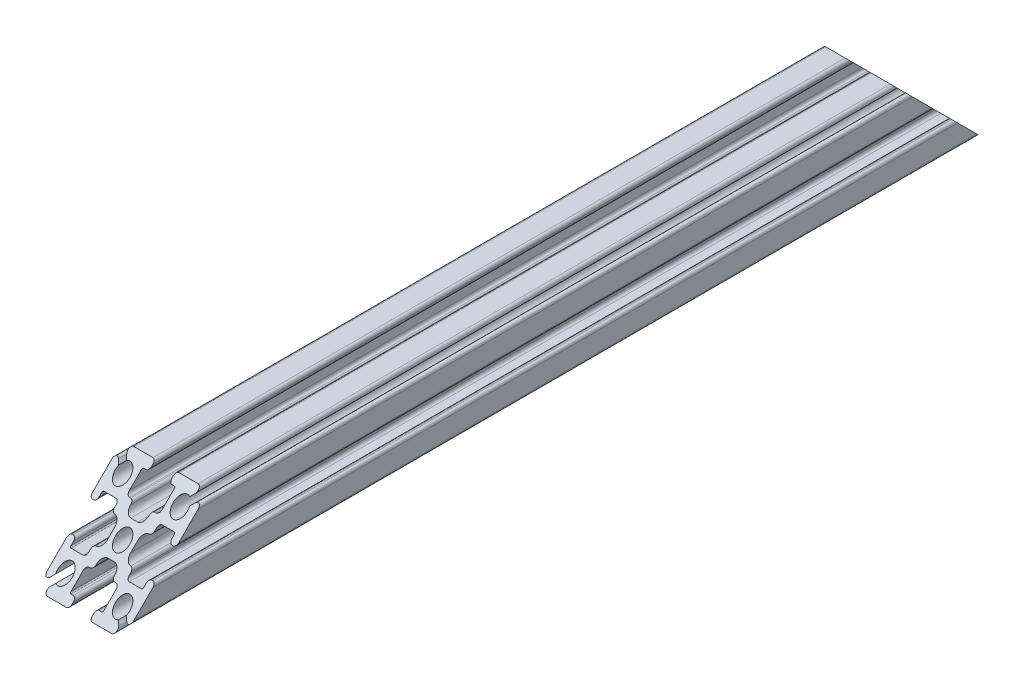
from build123d import *

# Parameters (mm, degrees)
SKETCH1_R           = 1.25
BOSS_EXTRUDE1_DEPTH = 150
CUT_EXTRUDE1_DEPTH  = 8
CUT_EXTRUDE2_DEPTH  = 8


with BuildPart() as part:
    # Sketch1 → Boss-Extrude1 (new body)
    with BuildSketch(Plane(origin=(0, 0, 0), x_dir=(-1, 0, 0), z_dir=(0, 0, -1))):
        with BuildLine():
            Line((6.646446609, 5.939339828), (6.163645978, 5.456539197))
            ThreePointArc((6.163645978, 5.456539197), (4.116116524, 4.116116524), (5.456539197, 6.163645978))
            Line((5.456539197, 6.163645978), (5.939339828, 6.646446609))
            ThreePointArc((5.939339828, 6.646446609), (6.047726204, 7.191341716), (5.585786438, 7.5))
            Line((5.585786438, 7.5), (2.25, 7.5))
            ThreePointArc((2.25, 7.5), (1.896446609, 7.353553391), (1.75, 7))
            Line((1.75, 7), (1.75, 6.8))
            ThreePointArc((1.75, 6.8), (1.896446609, 6.446446609), (2.25, 6.3))
            Line((2.25, 6.3), (2.65, 6.3))
            ThreePointArc((2.65, 6.3), (2.791421356, 6.241421356), (2.85, 6.1))
            Line((2.85, 6.1), (2.85, 4))
            ThreePointArc((2.85, 4), (2.703553391, 3.646446609), (2.35, 3.5))
            Line((2.35, 3.5), (2.1, 3.5))
            ThreePointArc((2.1, 3.5), (1.746446609, 3.353553391), (1.6, 3))
            ThreePointArc((1.6, 3), (1.307106781, 2.292893219), (0.6, 2))
            Line((0.6, 2), (-0.6, 2))
            ThreePointArc((-0.6, 2), (-1.307106781, 2.292893219), (-1.6, 3))
            ThreePointArc((-1.6, 3), (-1.746446609, 3.353553391), (-2.1, 3.5))
            Line((-2.1, 3.5), (-2.35, 3.5))
            ThreePointArc((-2.35, 3.5), (-2.703553391, 3.646446609), (-2.85, 4))
            Line((-2.85, 4), (-2.85, 6.1))
            ThreePointArc((-2.85, 6.1), (-2.791421356, 6.241421356), (-2.65, 6.3))
            Line((-2.65, 6.3), (-2.25, 6.3))
            ThreePointArc((-2.25, 6.3), (-1.896446609, 6.446446609), (-1.75, 6.8))
            Line((-1.75, 6.8), (-1.75, 7))
            ThreePointArc((-1.75, 7), (-1.896446609, 7.353553391), (-2.25, 7.5))
            Line((-2.25, 7.5), (-5.585786438, 7.5))
            ThreePointArc((-5.585786438, 7.5), (-6.047726204, 7.191341716), (-5.939339828, 6.646446609))
            Line((-5.939339828, 6.646446609), (-5.456539197, 6.163645978))
            ThreePointArc((-5.456539197, 6.163645978), (-4.116116524, 4.116116524), (-6.163645978, 5.456539197))
            Line((-6.163645978, 5.456539197), (-6.646446609, 5.939339828))
            ThreePointArc((-6.646446609, 5.939339828), (-7.191341716, 6.047726204), (-7.5, 5.585786438))
            Line((-7.5, 5.585786438), (-7.5, 2.25))
            ThreePointArc((-7.5, 2.25), (-7.353553391, 1.896446609), (-7, 1.75))
            Line((-7, 1.75), (-6.8, 1.75))
            ThreePointArc((-6.8, 1.75), (-6.446446609, 1.896446609), (-6.3, 2.25))
            Line((-6.3, 2.25), (-6.3, 2.65))
            ThreePointArc((-6.3, 2.65), (-6.241421356, 2.791421356), (-6.1, 2.85))
            Line((-6.1, 2.85), (-4, 2.85))
            ThreePointArc((-4, 2.85), (-3.646446609, 2.703553391), (-3.5, 2.35))
            Line((-3.5, 2.35), (-3.5, 2.1))
            ThreePointArc((-3.5, 2.1), (-3.353553391, 1.746446609), (-3, 1.6))
            ThreePointArc((-3, 1.6), (-2.292893219, 1.307106781), (-2, 0.6))
            Line((-2, 0.6), (-2, -0.6))
            ThreePointArc((-2, -0.6), (-2.292893219, -1.307106781), (-3, -1.6))
            ThreePointArc((-3, -1.6), (-3.353553391, -1.746446609), (-3.5, -2.1))
            Line((-3.5, -2.1), (-3.5, -2.35))
            ThreePointArc((-3.5, -2.35), (-3.646446609, -2.703553391), (-4, -2.85))
            Line((-4, -2.85), (-6.1, -2.85))
            ThreePointArc((-6.1, -2.85), (-6.241421356, -2.791421356), (-6.3, -2.65))
            Line((-6.3, -2.65), (-6.3, -2.25))
            ThreePointArc((-6.3, -2.25), (-6.446446609, -1.896446609), (-6.8, -1.75))
            Line((-6.8, -1.75), (-7, -1.75))
            ThreePointArc((-7, -1.75), (-7.353553391, -1.896446609), (-7.5, -2.25))
            Line((-7.5, -2.25), (-7.5, -5.585786438))
            ThreePointArc((-7.5, -5.585786438), (-7.191341716, -6.047726204), (-6.646446609, -5.939339828))
            Line((-6.646446609, -5.939339828), (-6.163645978, -5.456539197))
            ThreePointArc((-6.163645978, -5.456539197), (-4.116116524, -4.116116524), (-5.456539197, -6.163645978))
            Line((-5.456539197, -6.163645978), (-5.939339828, -6.646446609))
            ThreePointArc((-5.939339828, -6.646446609), (-6.047726204, -7.191341716), (-5.585786438, -7.5))
            Line((-5.585786438, -7.5), (-2.25, -7.5))
            ThreePointArc((-2.25, -7.5), (-1.896446609, -7.353553391), (-1.75, -7))
            Line((-1.75, -7), (-1.75, -6.8))
            ThreePointArc((-1.75, -6.8), (-1.896446609, -6.446446609), (-2.25, -6.3))
            Line((-2.25, -6.3), (-2.65, -6.3))
            ThreePointArc((-2.65, -6.3), (-2.791421356, -6.241421356), (-2.85, -6.1))
            Line((-2.85, -6.1), (-2.85, -4))
            ThreePointArc((-2.85, -4), (-2.703553391, -3.646446609), (-2.35, -3.5))
            Line((-2.35, -3.5), (-2.1, -3.5))
            ThreePointArc((-2.1, -3.5), (-1.746446609, -3.353553391), (-1.6, -3))
            ThreePointArc((-1.6, -3), (-1.307106781, -2.292893219), (-0.6, -2))
            Line((-0.6, -2), (0.6, -2))
            ThreePointArc((0.6, -2), (1.307106781, -2.292893219), (1.6, -3))
            ThreePointArc((1.6, -3), (1.746446609, -3.353553391), (2.1, -3.5))
            Line((2.1, -3.5), (2.35, -3.5))
            ThreePointArc((2.35, -3.5), (2.703553391, -3.646446609), (2.85, -4))
            Line((2.85, -4), (2.85, -6.1))
            ThreePointArc((2.85, -6.1), (2.791421356, -6.241421356), (2.65, -6.3))
            Line((2.65, -6.3), (2.25, -6.3))
            ThreePointArc((2.25, -6.3), (1.896446609, -6.446446609), (1.75, -6.8))
            Line((1.75, -6.8), (1.75, -7))
            ThreePointArc((1.75, -7), (1.896446609, -7.353553391), (2.25, -7.5))
            Line((2.25, -7.5), (5.585786438, -7.5))
            ThreePointArc((5.585786438, -7.5), (6.047726204, -7.191341716), (5.939339828, -6.646446609))
            Line((5.939339828, -6.646446609), (5.456539197, -6.163645978))
            ThreePointArc((5.456539197, -6.163645978), (4.116116524, -4.116116524), (6.163645978, -5.456539197))
            Line((6.163645978, -5.456539197), (6.646446609, -5.939339828))
            ThreePointArc((6.646446609, -5.939339828), (7.191341716, -6.047726204), (7.5, -5.585786438))
            Line((7.5, -5.585786438), (7.5, -2.25))
            ThreePointArc((7.5, -2.25), (7.353553391, -1.896446609), (7, -1.75))
            Line((7, -1.75), (6.8, -1.75))
            ThreePointArc((6.8, -1.75), (6.446446609, -1.896446609), (6.3, -2.25))
            Line((6.3, -2.25), (6.3, -2.65))
            ThreePointArc((6.3, -2.65), (6.241421356, -2.791421356), (6.1, -2.85))
            Line((6.1, -2.85), (4, -2.85))
            ThreePointArc((4, -2.85), (3.646446609, -2.703553391), (3.5, -2.35))
            Line((3.5, -2.35), (3.5, -2.1))
            ThreePointArc((3.5, -2.1), (3.353553391, -1.746446609), (3, -1.6))
            ThreePointArc((3, -1.6), (2.292893219, -1.307106781), (2, -0.6))
            Line((2, -0.6), (2, 0.6))
            ThreePointArc((2, 0.6), (2.292893219, 1.307106781), (3, 1.6))
            ThreePointArc((3, 1.6), (3.353553391, 1.746446609), (3.5, 2.1))
            Line((3.5, 2.1), (3.5, 2.35))
            ThreePointArc((3.5, 2.35), (3.646446609, 2.703553391), (4, 2.85))
            Line((4, 2.85), (6.1, 2.85))
            ThreePointArc((6.1, 2.85), (6.241421356, 2.791421356), (6.3, 2.65))
            Line((6.3, 2.65), (6.3, 2.25))
            ThreePointArc((6.3, 2.25), (6.446446609, 1.896446609), (6.8, 1.75))
            Line((6.8, 1.75), (7, 1.75))
            ThreePointArc((7, 1.75), (7.353553391, 1.896446609), (7.5, 2.25))
            Line((7.5, 2.25), (7.5, 5.585786438))
            ThreePointArc((7.5, 5.585786438), (7.191341716, 6.047726204), (6.646446609, 5.939339828))
        make_face()
        with Locations(Location((0, 0, 0), (0, 0, 180))):
            Circle(SKETCH1_R, mode=Mode.SUBTRACT)
    extrude(amount=-BOSS_EXTRUDE1_DEPTH)

    # Sketch9 → Cut-Extrude1 (cut, symmetric)
    with BuildSketch(Plane(origin=(0, 0, 0), x_dir=(0, 0, -1), z_dir=(1, 0, 0))):
        Polygon((0, -7.5), (0, 7.5), (-15, 7.5), align=None)
    extrude(amount=CUT_EXTRUDE1_DEPTH, both=True, mode=Mode.SUBTRACT)

    # Sketch10 → Cut-Extrude2 (cut, symmetric)
    with BuildSketch(Plane(origin=(0, 0, 0), x_dir=(0, 0, -1), z_dir=(1, 0, 0))):
        Polygon((-150, -7.5), (-150, 7.5), (-135, 7.5), align=None)
    extrude(amount=CUT_EXTRUDE2_DEPTH, both=True, mode=Mode.SUBTRACT)


solid = part.part
